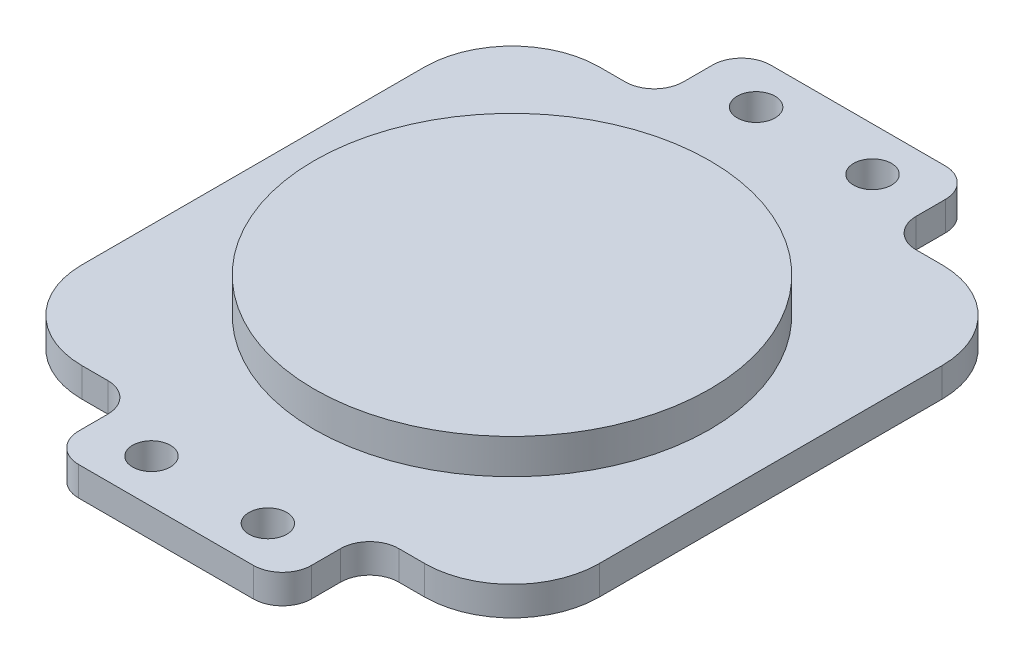
from build123d import *

# Parameters (mm, degrees)
SKETCH1_W           = 88.9
SKETCH1_H           = 88.9
BOSS_EXTRUDE1_DEPTH = 5
SKETCH2_R           = 34
BOSS_EXTRUDE2_DEPTH = 6
SKETCH3_W           = 20
SKETCH3_H           = 15
BOSS_EXTRUDE3_DEPTH = 5
SKETCH4_R           = 3.25
CUT_EXTRUDE1_DEPTH  = 5
FILLET1_R           = 15
FILLET2_R           = 5


with BuildPart() as part:
    # Sketch1 → Boss-Extrude1 (new body)
    with BuildSketch(Plane(origin=(0, 0, 0), x_dir=(1, 0, 0), z_dir=(0, 1, 0))):
        Rectangle(SKETCH1_W, SKETCH1_H)
    extrude(amount=BOSS_EXTRUDE1_DEPTH)

    # Sketch2 → Boss-Extrude2 (add)
    with BuildSketch(Plane(origin=(0, 5, 0), x_dir=(1, 0, 0), z_dir=(0, 1, 0))):
        with Locations(Location((0, 0, 0), (0, 0, 270))):
            Circle(SKETCH2_R)
    extrude(amount=BOSS_EXTRUDE2_DEPTH)

    # Sketch3 → Boss-Extrude3 (add)
    with BuildSketch(Plane.XZ):
        with Locations((-10, 51.95)):
            Rectangle(SKETCH3_W, SKETCH3_H)
        with Locations((10, 51.95)):
            Rectangle(SKETCH3_W, SKETCH3_H)
        with Locations((10, -51.95)):
            Rectangle(SKETCH3_W, SKETCH3_H)
        with Locations((-10, -51.95)):
            Rectangle(SKETCH3_W, SKETCH3_H)
    extrude(amount=-BOSS_EXTRUDE3_DEPTH)

    # Sketch4 → Cut-Extrude1 (cut)
    with BuildSketch(Plane.XZ):
        with Locations(Location((10, 51.95, 0), (0, 0, 270))):
            Circle(SKETCH4_R)
        with Locations(Location((-10, 51.95, 0), (0, 0, 270))):
            Circle(SKETCH4_R)
        with Locations(Location((10, -51.95, 0), (0, 0, 270))):
            Circle(SKETCH4_R)
        with Locations(Location((-10, -51.95, 0), (0, 0, 270))):
            Circle(SKETCH4_R)
    extrude(amount=-CUT_EXTRUDE1_DEPTH, mode=Mode.SUBTRACT)

    # Fillet1
    fillet1_edges = [part.edges().sort_by_distance(p)[0] for p in [
        (44.45, 2.5, 44.45),
        (-44.45, 2.5, 44.45),
        (-44.45, 2.5, -44.45),
        (44.45, 2.5, -44.45),
    ]]
    fillet(fillet1_edges, radius=FILLET1_R)

    # Fillet2
    fillet2_edges = [part.edges().sort_by_distance(p)[0] for p in [
        (-20, 2.5, 44.45),
        (-20, 2.5, 59.45),
        (20, 2.5, 59.45),
        (20, 2.5, 44.45),
        (20, 2.5, -44.45),
        (20, 2.5, -59.45),
        (-20, 2.5, -59.45),
        (-20, 2.5, -44.45),
    ]]
    fillet(fillet2_edges, radius=FILLET2_R)


solid = part.part
